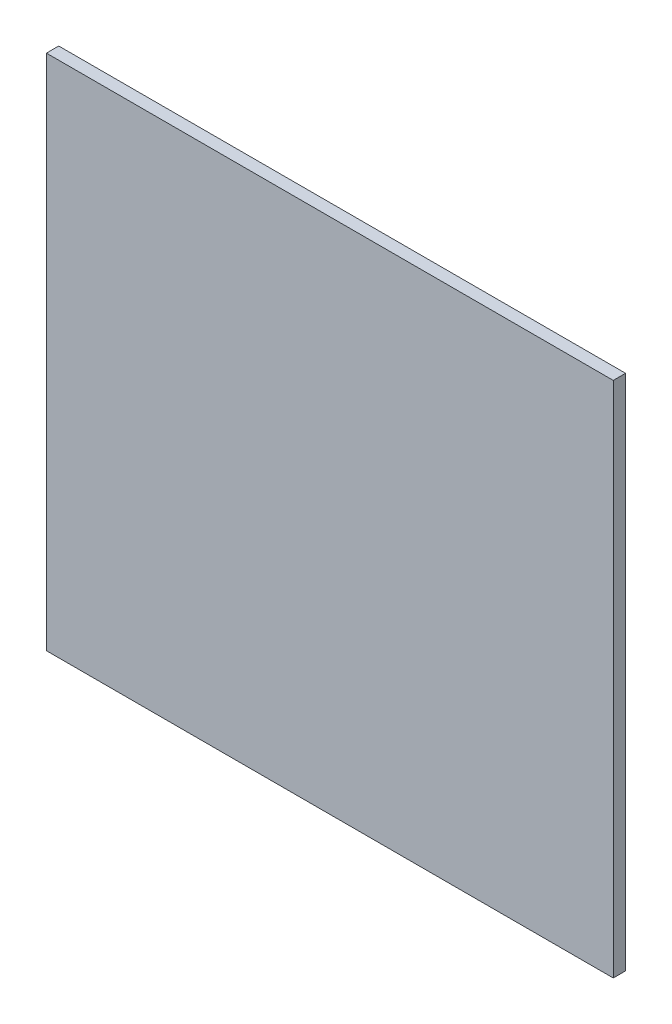
from build123d import *

# Parameters (mm, degrees)
ESQUISSE1_W        = 46
ESQUISSE1_H        = 42
BOSS_EXTRU_1_DEPTH = 1


with BuildPart() as part:
    # Esquisse1 → Boss.-Extru.1 (new body)
    with BuildSketch(Plane.XY):
        Rectangle(ESQUISSE1_W, ESQUISSE1_H)
    extrude(amount=BOSS_EXTRU_1_DEPTH)


solid = part.part
